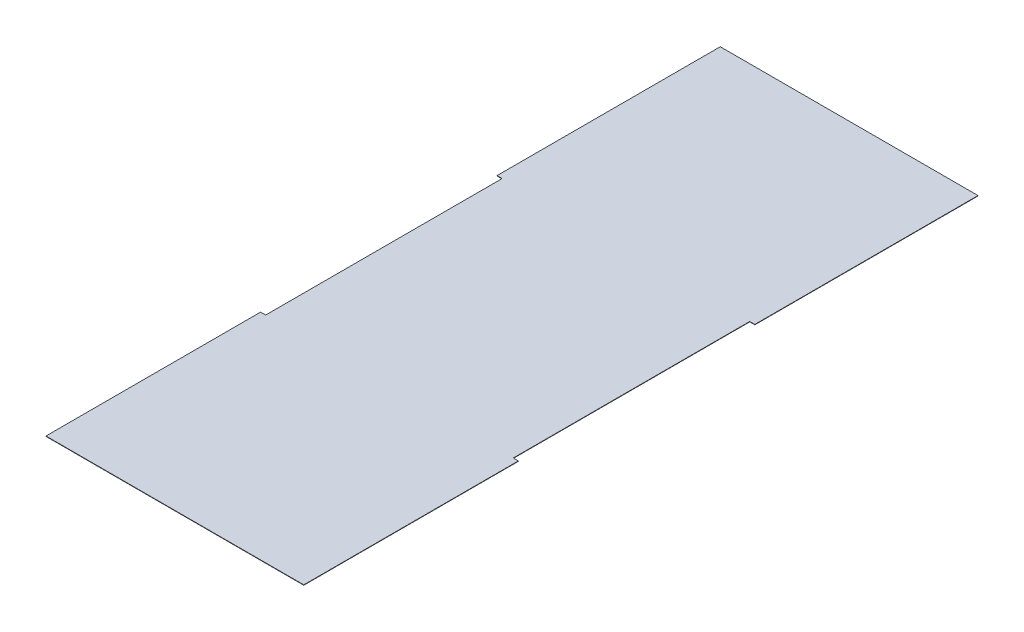
from build123d import *

# Parameters (mm, degrees)
SKETCH1_W           = 1923
SKETCH1_H           = 5030
BOSS_EXTRUDE1_DEPTH = 3
SKETCH2_W           = 38
SKETCH2_H           = 1764
CUT_EXTRUDE1_DEPTH  = 3


with BuildPart() as part:
    # Sketch1 → Boss-Extrude1 (new body)
    with BuildSketch(Plane(origin=(0, 0, 0), x_dir=(1, 0, 0), z_dir=(0, 1, 0))):
        with Locations((961.5, 2515)):
            Rectangle(SKETCH1_W, SKETCH1_H)
    extrude(amount=BOSS_EXTRUDE1_DEPTH)

    # Sketch2 → Cut-Extrude1 (cut)
    with BuildSketch(Plane(origin=(0, 3, 0), x_dir=(1, 0, 0), z_dir=(0, 1, 0))):
        with Locations((19, 2483)):
            Rectangle(SKETCH2_W, SKETCH2_H)
        with Locations((1904, 2483)):
            Rectangle(SKETCH2_W, SKETCH2_H)
    extrude(amount=-CUT_EXTRUDE1_DEPTH, mode=Mode.SUBTRACT)


solid = part.part
